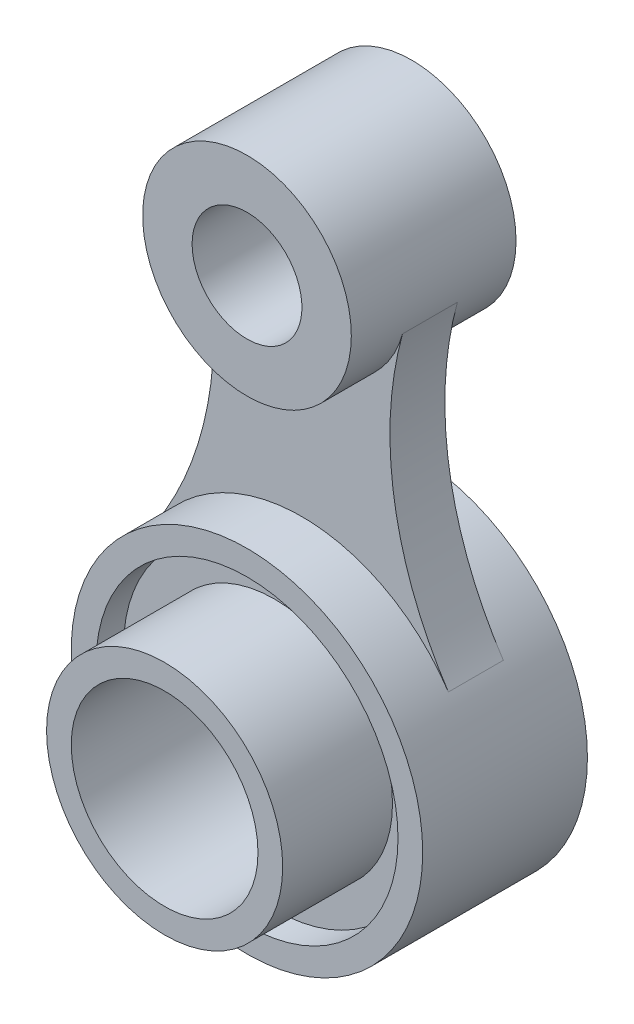
from build123d import *

# Parameters (mm, degrees)
SKETCH2_R             = 19
BOSS_EXTRUDE1_DEPTH   = 30
SKETCH2_R_2           = 32
BOSS_EXTRUDE1_2_DEPTH = 30
BOSS_EXTRUDE2_DEPTH   = 10
SKETCH4_R             = 27.5
CUT_EXTRUDE1_DEPTH    = 5
SKETCH5_R             = 21.5
BOSS_EXTRUDE3_DEPTH   = 20
SKETCH6_R             = 10
SKETCH6_R_2           = 17
CUT_EXTRUDE2_DEPTH    = 89.765139554


with BuildPart() as part:
    # Sketch2 → Boss-Extrude1 (new body)
    with BuildSketch(Plane.XY):
        with Locations((0, 37.5)):
            Circle(SKETCH2_R)
    extrude(amount=BOSS_EXTRUDE1_DEPTH)



with BuildPart() as body_2:
    # Sketch2 → Boss-Extrude1 2 (new body)
    with BuildSketch(Plane.XY):
        with Locations((0, -37.5)):
            Circle(SKETCH2_R_2)
    extrude(amount=BOSS_EXTRUDE1_2_DEPTH)


with BuildPart() as part_1:
    add(part.part)

    add(body_2.part)  # Boss-Extrude2 merges body 2
    # Sketch3 → Boss-Extrude2 (add)
    with BuildSketch(Plane.XY.offset(10)):
        with BuildLine():
            ThreePointArc((-18.321243986, 32.466907631), (0, 18.5), (18.321243986, 32.466907631))
            ThreePointArc((18.321243986, 32.466907631), (16.836772686, 5.414041255), (26.678302647, -19.828888889))
            ThreePointArc((26.678302647, -19.828888889), (0, -5.5), (-26.678302647, -19.828888889))
            ThreePointArc((-26.678302647, -19.828888889), (-16.836772686, 5.414041255), (-18.321243986, 32.466907631))
        make_face()
    extrude(amount=BOSS_EXTRUDE2_DEPTH)

    # Sketch4 → Cut-Extrude1 (cut)
    with BuildSketch(Plane.XY.offset(25)):
        with Locations((0, -37.5)):
            Circle(SKETCH4_R)
    extrude(amount=CUT_EXTRUDE1_DEPTH, mode=Mode.SUBTRACT)

    # Sketch5 → Boss-Extrude3 (add)
    with BuildSketch(Plane.XY.offset(25)):
        with Locations((0, -37.5)):
            Circle(SKETCH5_R)
    extrude(amount=BOSS_EXTRUDE3_DEPTH)

    # Sketch6 → Cut-Extrude2 (cut, through all)
    with BuildSketch(Plane.XY):
        with Locations(Location((0, 37.5, 0), (0, 0, 180))):
            Circle(SKETCH6_R)
        with Locations(Location((0, -37.5, 0), (0, 0, 180))):
            Circle(SKETCH6_R_2)
    extrude(amount=CUT_EXTRUDE2_DEPTH, mode=Mode.SUBTRACT)


solid = part_1.part
